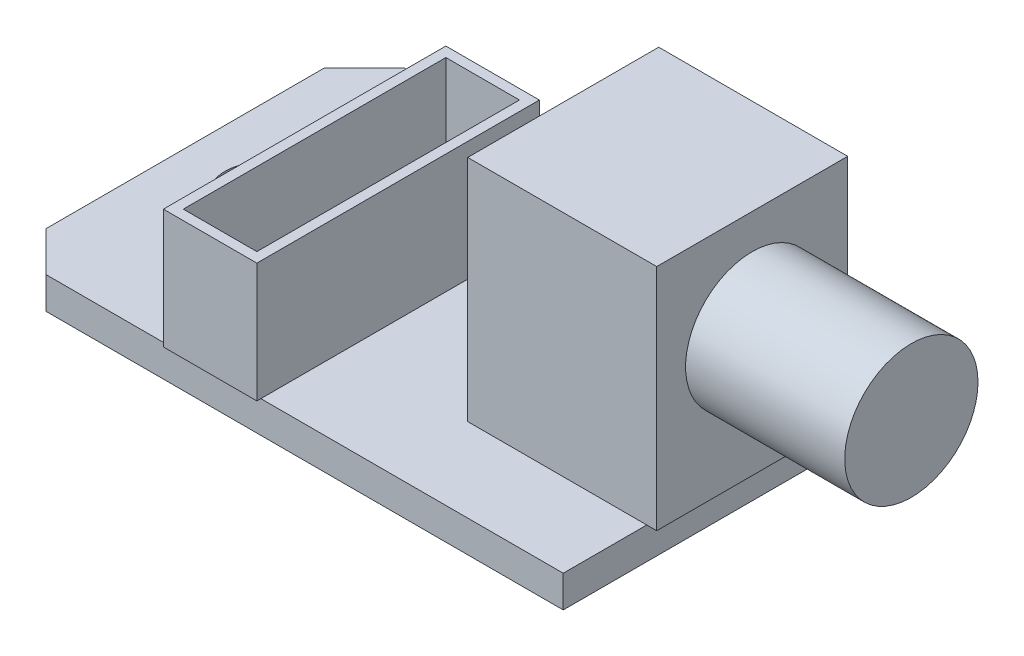
from build123d import *

# Parameters (mm, degrees)
SKETCH2_W                = 28
SKETCH2_H                = 18
BOSS_EXTRUDE1_DEPTH      = 1.6
BOSS_EXTRUDE2_DEPTH      = 0.5
BOSS_EXTRUDE2_DEPTH_BACK = 9
SKETCH4_W                = 9.6
SKETCH4_H                = 11.5
SKETCH5_R                = 3.35
BOSS_EXTRUDE3_DEPTH      = 8
SKETCH6_W                = 4.7
SKETCH6_H                = 14.2
BOSS_EXTRUDE4_DEPTH      = 6
SKETCH7_R                = 1.9
CUT_EXTRUDE1_DEPTH       = 27.891262521
CHAMFER1_SIZE            = 2
SKETCH8_W                = 3.7
SKETCH8_H                = 13.2
CUT_EXTRUDE2_DEPTH       = 5


with BuildPart() as part:
    # Sketch2 → Boss-Extrude1 (new body)
    with BuildSketch(Plane(origin=(0, 0, 0), x_dir=(1, 0, 0), z_dir=(0, 1, 0))):
        Rectangle(SKETCH2_W, SKETCH2_H)
    extrude(amount=BOSS_EXTRUDE1_DEPTH)

    # Sketch4 → Boss-Extrude2 (add, two sides: drawn at the far end of the back side and taken through both)
    with BuildSketch(Plane(origin=(14, 0, 0), x_dir=(0, 0, -1), z_dir=(1, 0, 0)).offset(-BOSS_EXTRUDE2_DEPTH_BACK)):
        with Locations((0, 7.35)):
            Rectangle(SKETCH4_W, SKETCH4_H)
    extrude(amount=BOSS_EXTRUDE2_DEPTH + BOSS_EXTRUDE2_DEPTH_BACK)

    # Sketch5 → Boss-Extrude3 (add)
    with BuildSketch(Plane(origin=(14.5, 0, 0), x_dir=(0, 0, -1), z_dir=(1, 0, 0))):
        with Locations((0, 8)):
            Circle(SKETCH5_R)
    extrude(amount=BOSS_EXTRUDE3_DEPTH)

    # Sketch6 → Boss-Extrude4 (add)
    with BuildSketch(Plane(origin=(0, 1.6, 0), x_dir=(1, 0, 0), z_dir=(0, 1, 0))):
        with Locations((-3.55, -2.1)):
            Rectangle(SKETCH6_W, SKETCH6_H)
    extrude(amount=BOSS_EXTRUDE4_DEPTH)

    # Sketch7 → Cut-Extrude1 (cut, through all)
    with BuildSketch(Plane(origin=(0, 1.6, 0), x_dir=(1, 0, 0), z_dir=(0, 1, 0))):
        with Locations(Location((-10.1, 0, 0), (0, 0, 270))):
            Circle(SKETCH7_R)
    extrude(amount=-CUT_EXTRUDE1_DEPTH, mode=Mode.SUBTRACT)

    # Chamfer1
    chamfer1_edges = [part.edges().sort_by_distance(p)[0] for p in [
        (-14, 0.8, -9),
        (-14, 0.8, 9),
    ]]
    chamfer(chamfer1_edges, length=CHAMFER1_SIZE)

    # Sketch8 → Cut-Extrude2 (cut)
    with BuildSketch(Plane(origin=(0, 7.6, 0), x_dir=(1, 0, 0), z_dir=(0, 1, 0))):
        with Locations((-3.55, -2.1)):
            Rectangle(SKETCH8_W, SKETCH8_H)
    extrude(amount=-CUT_EXTRUDE2_DEPTH, mode=Mode.SUBTRACT)


solid = part.part
